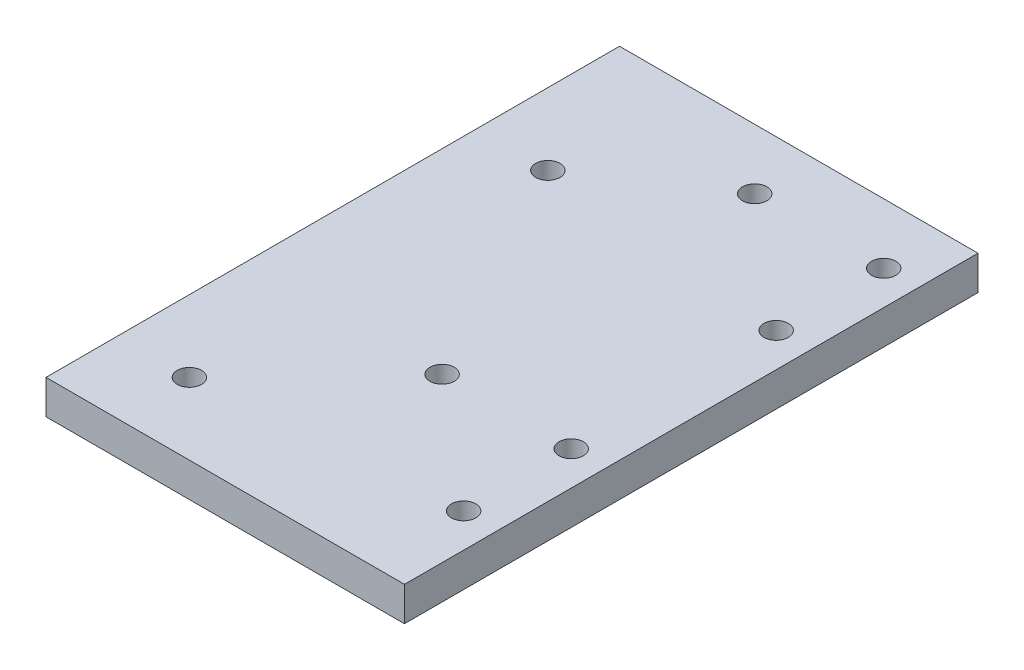
from build123d import *

# Parameters (mm, degrees)
SKETCH1_R           = 1.7
BOSS_EXTRUDE1_DEPTH = 4.7625


with BuildPart() as part:
    # Sketch1 → Boss-Extrude1 (new body)
    with BuildSketch(Plane(origin=(0, 0, 0), x_dir=(1, 0, 0), z_dir=(0, 1, 0))):
        Polygon((0, 90), (0, 10), (20, 10), (50, 10), (50, 90), align=None)
        with Locations(Location((10, 20, 0), (0, 0, 90))):
            Circle(SKETCH1_R, mode=Mode.SUBTRACT)
        with Locations(Location((27.25, 38, 0), (0, 0, 90))):
            Circle(SKETCH1_R, mode=Mode.SUBTRACT)
        with Locations(Location((45.25, 23, 0), (0, 0, 90))):
            Circle(SKETCH1_R, mode=Mode.SUBTRACT)
        with Locations(Location((45.25, 38, 0), (0, 0, 90))):
            Circle(SKETCH1_R, mode=Mode.SUBTRACT)
        with Locations(Location((10, 70, 0), (0, 0, 90))):
            Circle(SKETCH1_R, mode=Mode.SUBTRACT)
        with Locations(Location((45.25, 66.6, 0), (0, 0, 90))):
            Circle(SKETCH1_R, mode=Mode.SUBTRACT)
        with Locations(Location((27.25, 81.6, 0), (0, 0, 90))):
            Circle(SKETCH1_R, mode=Mode.SUBTRACT)
        with Locations(Location((45.25, 81.6, 0), (0, 0, 90))):
            Circle(SKETCH1_R, mode=Mode.SUBTRACT)
    extrude(amount=BOSS_EXTRUDE1_DEPTH)


solid = part.part
